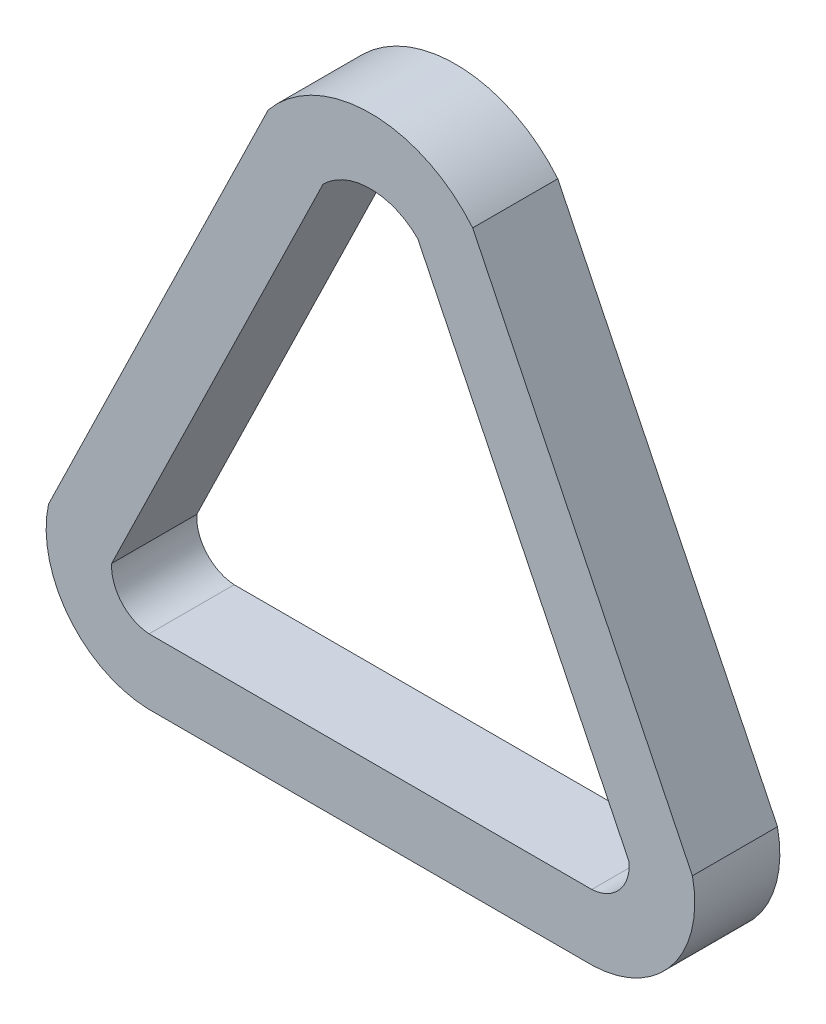
from build123d import *

# Parameters (mm, degrees)
RESSALTO_EXTRUS_O1_DEPTH = 13


with BuildPart() as part:
    # Esboço1 → Ressalto-extrusão1 (new body)
    with BuildSketch(Plane.XY):
        with BuildLine():
            Line((15.615884134, 38.544843573), (49.178873209, -30.38837245))
            ThreePointArc((49.178873209, -30.38837245), (46.159645688, -43.661031044), (34.049419966, -49.87566168))
            Line((34.049419966, -49.87566168), (-34.049419966, -49.87566168))
            ThreePointArc((-34.049419966, -49.87566168), (-46.159645688, -43.661031044), (-49.178873209, -30.38837245))
            Line((-49.178873209, -30.38837245), (-15.615884134, 38.544843573))
            ThreePointArc((-15.615884134, 38.544843573), (0, 45.915020285), (15.615884134, 38.544843573))
        make_face()
        with BuildLine():
            Line((-7.232646643, 32.919159954), (-39.530690371, -33.416052934))
            ThreePointArc((-39.530690371, -33.416052934), (-38.011384509, -37.829321224), (-33.816421096, -39.87566168))
            Line((-33.816421096, -39.87566168), (33.816421096, -39.87566168))
            ThreePointArc((33.816421096, -39.87566168), (38.011384509, -37.829321224), (39.530690371, -33.416052934))
            Line((39.530690371, -33.416052934), (7.232646643, 32.919159954))
            ThreePointArc((7.232646643, 32.919159954), (0, 35.915020285), (-7.232646643, 32.919159954))
        make_face(mode=Mode.SUBTRACT)
    extrude(amount=RESSALTO_EXTRUS_O1_DEPTH)


solid = part.part
